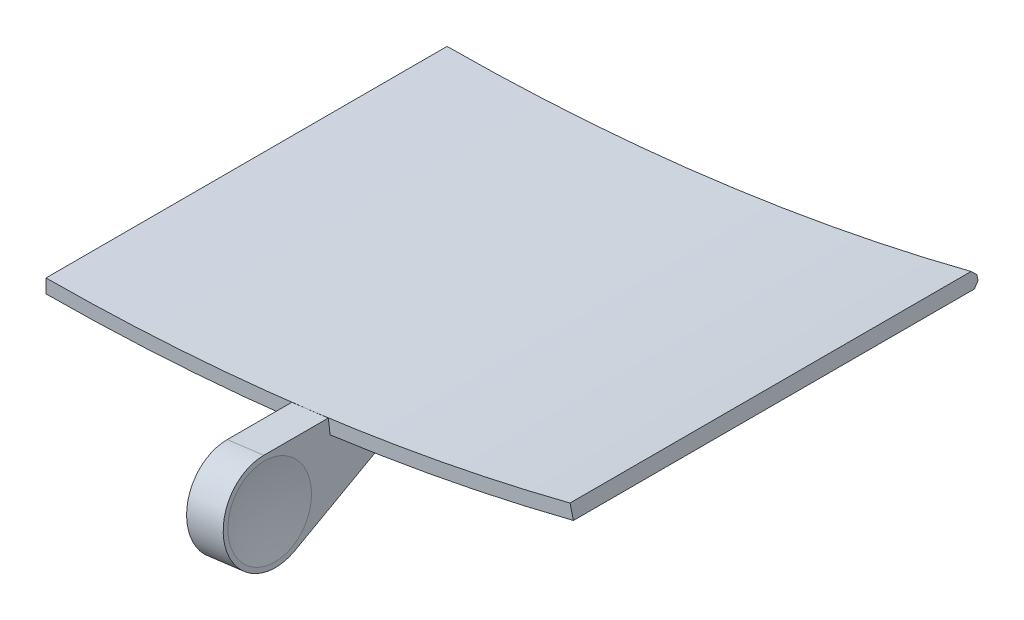
from build123d import *

# Parameters (mm, degrees)
EXTRUDE_1_DEPTH      = 44
CHAMFER_1_SIZE       = 0.5
CUT_EXTRUDE_1_DEPTH  = 248.825273255
EXTRUDE_3_DEPTH      = 2
EXTRUDE_3_DEPTH_BACK = 2


with BuildPart() as part:
    # 草图1 → 凸台-拉伸1 (new body)
    with BuildSketch(Plane.XY):
        with BuildLine():
            Line((0, -235), (0, -236.5))
            ThreePointArc((0, -236.5), (30.030308588, -234.585657205), (59.57445815, -228.87362001))
            Line((59.57445815, -228.87362001), (59.196607464, -227.421990285))
            ThreePointArc((59.196607464, -227.421990285), (29.839841515, -233.097798914), (0, -235))
        make_face()
    extrude(amount=EXTRUDE_1_DEPTH)

    # 倒角1
    chamfer_1_edges = [part.edges().sort_by_distance(p)[0] for p in [
        (0, -235.75, 0),
        (30.030308588, -234.585657205, 0),
        (59.385532807, -228.147805147, 0),
        (29.839841515, -233.097798914, 0),
    ]]
    chamfer(chamfer_1_edges, length=CHAMFER_1_SIZE)

    # 草图4 → 切除-拉伸1 (cut, through all)
    with BuildSketch(Plane.XY.offset(44)):
        with BuildLine():
            Line((1.2, -234.99693615), (1.2, -236.496955584))
            ThreePointArc((1.2, -236.496955584), (0.600001931, -236.499238895), (0, -236.500000001))
            Line((0, -236.500000001), (0, -235))
            ThreePointArc((0, -235), (0.600001956, -234.999234036), (1.2, -234.99693615))
        make_face()
        with BuildLine():
            Line((59.57445815, -228.87362001), (59.196607464, -227.421990284))
            ThreePointArc((59.196607464, -227.421990284), (58.615760734, -227.572389787), (58.034531898, -227.721305783))
            Line((58.034531898, -227.721305783), (58.41238748, -229.172954315))
            ThreePointArc((58.41238748, -229.172954315), (58.993612668, -229.024024209), (59.57445815, -228.87362001))
        make_face()
    extrude(amount=-CUT_EXTRUDE_1_DEPTH, mode=Mode.SUBTRACT)

    # 草图5 → 凸台-拉伸3 (add, two sides: drawn at the far end of the back side and taken through both)
    with BuildSketch(Plane(origin=(0, 0, 0), x_dir=(0, 0, 1), z_dir=(-0.9919055272920719, -0.12697804899838705, 0)).offset(-EXTRUDE_3_DEPTH_BACK)):
        with BuildLine():
            Line((44, -235), (51, -235))
            ThreePointArc((51, -235), (55.880963165, -241.084526895), (48.88258567, -244.529520566))
            Line((48.88258567, -244.529520566), (29, -235.23501109))
            Line((29, -235.23501109), (44, -235.23501109))
            Line((44, -235.23501109), (44, -235))
        make_face()
    extrude(amount=EXTRUDE_3_DEPTH + EXTRUDE_3_DEPTH_BACK)

    # 草图6 → 切除-旋转2 (revolve, cut)
    with BuildSketch(Plane(origin=(30.47473176, -238.05732655, 0), x_dir=(-0.9919055272920719, -0.12697804899838705, 0), z_dir=(0.12697804899838705, -0.9919055272920719, 0))):
        with BuildLine():
            Line((-2, -51), (-2, -55.5))
            ThreePointArc((-2, -55.5), (-1.571903609, -53.267079519), (-1.4, -51))
            Line((-1.4, -51), (-2, -51))
        make_face()
        with BuildLine():
            Line((2, -51), (1.4, -51))
            ThreePointArc((1.4, -51), (1.571903609, -53.267079519), (2, -55.5))
            Line((2, -55.5), (2, -51))
        make_face()
    revolve(axis=Axis((28.490920705, -238.311282648, 51), (-0.9919055272920719, -0.12697804899838705, 0)), mode=Mode.SUBTRACT)


solid = part.part
